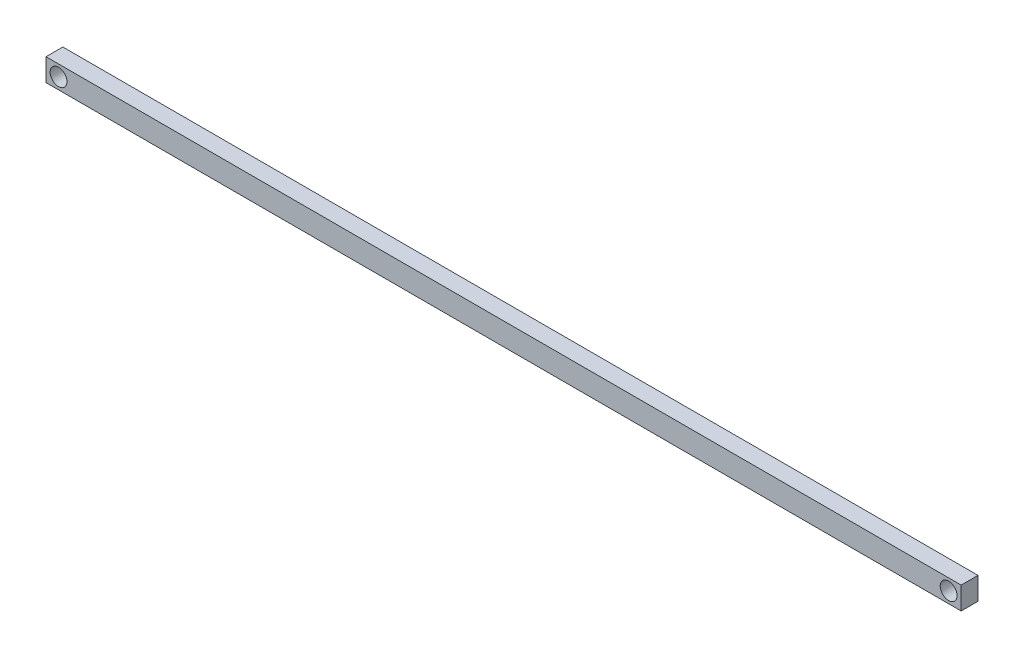
from build123d import *

# Parameters (mm, degrees)
SKETCH1_W           = 815
SKETCH1_H           = 20
SKETCH1_R           = 7.5
BOSS_EXTRUDE1_DEPTH = 15


with BuildPart() as part:
    # Sketch1 → Boss-Extrude1 (new body)
    with BuildSketch(Plane.XY):
        Rectangle(SKETCH1_W, SKETCH1_H)
        with Locations((-396.345, 0)):
            Circle(SKETCH1_R, mode=Mode.SUBTRACT)
        with Locations((396.345, 0)):
            Circle(SKETCH1_R, mode=Mode.SUBTRACT)
    extrude(amount=BOSS_EXTRUDE1_DEPTH)


solid = part.part
